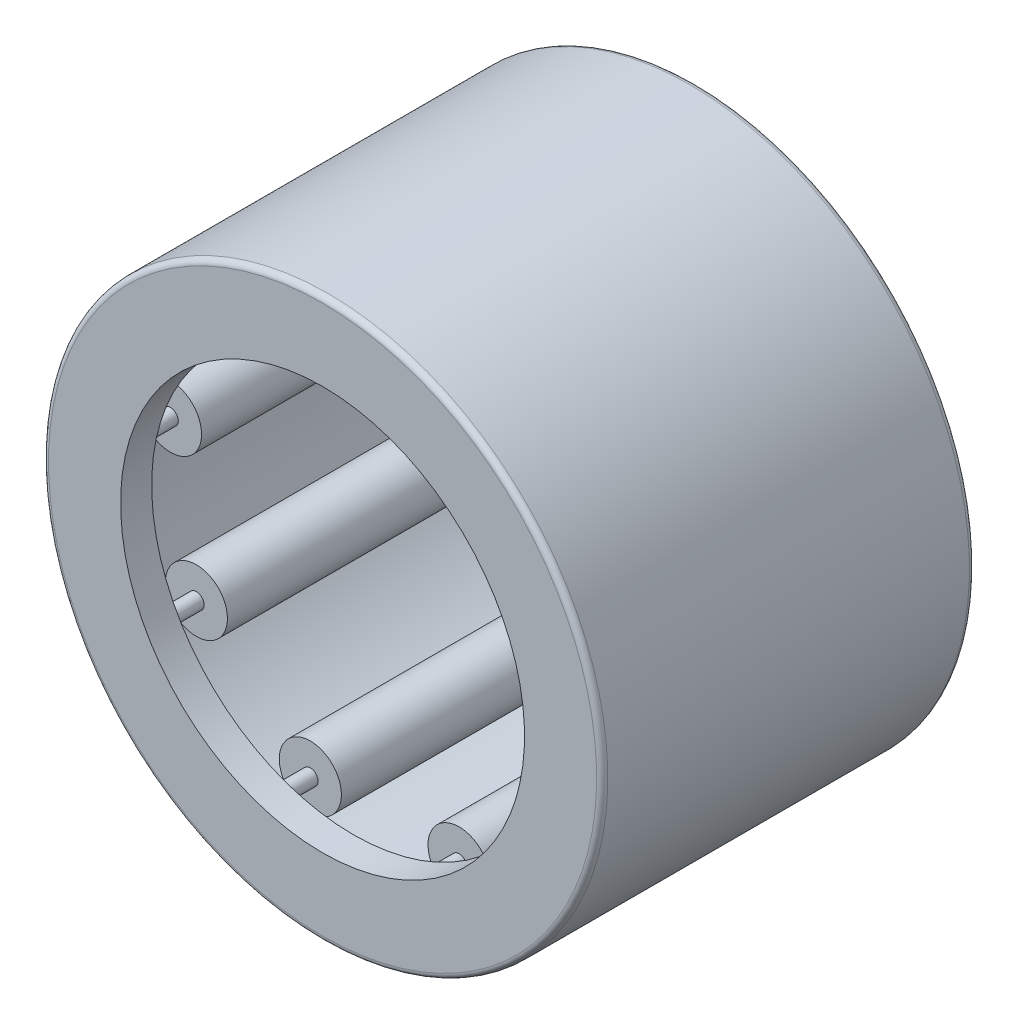
from build123d import *

# Parameters (mm, degrees)
SKETCH2_W         = 5.333333334
SKETCH2_H         = 0.5
SKETCH3_W         = 6.666666666
SKETCH3_H         = 0.166666666
CIRPATTERN1_COUNT = 9
CIRPATTERN1_ANGLE = 320
FILLET1_R         = 0.12


with BuildPart() as part:
    # Sketch1 → Revolve1 (revolve)
    with BuildSketch(Plane(origin=(0, 0, 0), x_dir=(0, 0, -1), z_dir=(1, 0, 0)), mode=Mode.PRIVATE) as revolve1_sk:
        Polygon((-4, 6), (4, 6), (4, 4.333333333), (3.333333333, 4.333333333), (3.333333333, 5.333333333), (-3.333333333, 5.333333333), (-3.333333333, 4.333333333), (-4, 4.333333333), align=None)
    revolve(revolve1_sk.sketch.rotate(Axis((0, 0, 4), (0, 0, -1)), 180), axis=Axis((0, 0, 4), (0, 0, -1)))

    # Fillet1
    fillet1_edges = [part.edges().sort_by_distance(p)[0] for p in [
        (0, 6, 4),
        (0, 6, -4),
    ]]
    fillet(fillet1_edges, radius=FILLET1_R)


with BuildPart() as body_2:
    # Sketch2 → Revolve2 (revolve)
    with BuildSketch(Plane(origin=(0, 0, 0), x_dir=(0, 0, -1), z_dir=(1, 0, 0)), mode=Mode.PRIVATE) as revolve2_sk:
        with Locations((0, 5.083333333)):
            Rectangle(SKETCH2_W, SKETCH2_H)
    revolve(revolve2_sk.sketch.rotate(Axis((0, 4.666666667, 2.666666667), (0, 0, -1)), 180), axis=Axis((0, 4.666666667, 2.666666667), (0, 0, -1)))


with BuildPart() as body_3:
    # Sketch3 → Revolve3 (revolve)
    with BuildSketch(Plane(origin=(0, 0, 0), x_dir=(0, 0, -1), z_dir=(1, 0, 0)), mode=Mode.PRIVATE) as revolve3_sk:
        with Locations((0, 4.75)):
            Rectangle(SKETCH3_W, SKETCH3_H)
    revolve(revolve3_sk.sketch.rotate(Axis((0, 4.666666667, 3.333333333), (0, 0, -1)), 90), axis=Axis((0, 4.666666667, 3.333333333), (0, 0, -1)))


with BuildPart() as cirpattern1_1:
    # CirPattern1: pattern copy
    add(body_2.part.rotate(Axis((0, 0, -4), (0, 0, 1)), 1 * CIRPATTERN1_ANGLE / (CIRPATTERN1_COUNT - 1)))


with BuildPart() as cirpattern1_2:
    # CirPattern1: pattern copy
    add(body_2.part.rotate(Axis((0, 0, -4), (0, 0, 1)), 2 * CIRPATTERN1_ANGLE / (CIRPATTERN1_COUNT - 1)))


with BuildPart() as cirpattern1_3:
    # CirPattern1: pattern copy
    add(body_2.part.rotate(Axis((0, 0, -4), (0, 0, 1)), 3 * CIRPATTERN1_ANGLE / (CIRPATTERN1_COUNT - 1)))


with BuildPart() as cirpattern1_4:
    # CirPattern1: pattern copy
    add(body_2.part.rotate(Axis((0, 0, -4), (0, 0, 1)), 4 * CIRPATTERN1_ANGLE / (CIRPATTERN1_COUNT - 1)))


with BuildPart() as cirpattern1_5:
    # CirPattern1: pattern copy
    add(body_2.part.rotate(Axis((0, 0, -4), (0, 0, 1)), 5 * CIRPATTERN1_ANGLE / (CIRPATTERN1_COUNT - 1)))


with BuildPart() as cirpattern1_6:
    # CirPattern1: pattern copy
    add(body_2.part.rotate(Axis((0, 0, -4), (0, 0, 1)), 6 * CIRPATTERN1_ANGLE / (CIRPATTERN1_COUNT - 1)))


with BuildPart() as cirpattern1_7:
    # CirPattern1: pattern copy
    add(body_2.part.rotate(Axis((0, 0, -4), (0, 0, 1)), 7 * CIRPATTERN1_ANGLE / (CIRPATTERN1_COUNT - 1)))


with BuildPart() as cirpattern1_8:
    # CirPattern1: pattern copy
    add(body_2.part.rotate(Axis((0, 0, -4), (0, 0, 1)), 8 * CIRPATTERN1_ANGLE / (CIRPATTERN1_COUNT - 1)))


with BuildPart() as cirpattern1_9:
    # CirPattern1: pattern copy
    add(body_3.part.rotate(Axis((0, 0, -4), (0, 0, 1)), 1 * CIRPATTERN1_ANGLE / (CIRPATTERN1_COUNT - 1)))


with BuildPart() as cirpattern1_10:
    # CirPattern1: pattern copy
    add(body_3.part.rotate(Axis((0, 0, -4), (0, 0, 1)), 2 * CIRPATTERN1_ANGLE / (CIRPATTERN1_COUNT - 1)))


with BuildPart() as cirpattern1_11:
    # CirPattern1: pattern copy
    add(body_3.part.rotate(Axis((0, 0, -4), (0, 0, 1)), 3 * CIRPATTERN1_ANGLE / (CIRPATTERN1_COUNT - 1)))


with BuildPart() as cirpattern1_12:
    # CirPattern1: pattern copy
    add(body_3.part.rotate(Axis((0, 0, -4), (0, 0, 1)), 4 * CIRPATTERN1_ANGLE / (CIRPATTERN1_COUNT - 1)))


with BuildPart() as cirpattern1_13:
    # CirPattern1: pattern copy
    add(body_3.part.rotate(Axis((0, 0, -4), (0, 0, 1)), 5 * CIRPATTERN1_ANGLE / (CIRPATTERN1_COUNT - 1)))


with BuildPart() as cirpattern1_14:
    # CirPattern1: pattern copy
    add(body_3.part.rotate(Axis((0, 0, -4), (0, 0, 1)), 6 * CIRPATTERN1_ANGLE / (CIRPATTERN1_COUNT - 1)))


with BuildPart() as cirpattern1_15:
    # CirPattern1: pattern copy
    add(body_3.part.rotate(Axis((0, 0, -4), (0, 0, 1)), 7 * CIRPATTERN1_ANGLE / (CIRPATTERN1_COUNT - 1)))


with BuildPart() as cirpattern1_16:
    # CirPattern1: pattern copy
    add(body_3.part.rotate(Axis((0, 0, -4), (0, 0, 1)), 8 * CIRPATTERN1_ANGLE / (CIRPATTERN1_COUNT - 1)))


solid = Compound([part.part, body_2.part, body_3.part, cirpattern1_1.part, cirpattern1_2.part, cirpattern1_3.part, cirpattern1_4.part, cirpattern1_5.part, cirpattern1_6.part, cirpattern1_7.part, cirpattern1_8.part, cirpattern1_9.part, cirpattern1_10.part, cirpattern1_11.part, cirpattern1_12.part, cirpattern1_13.part, cirpattern1_14.part, cirpattern1_15.part, cirpattern1_16.part])
